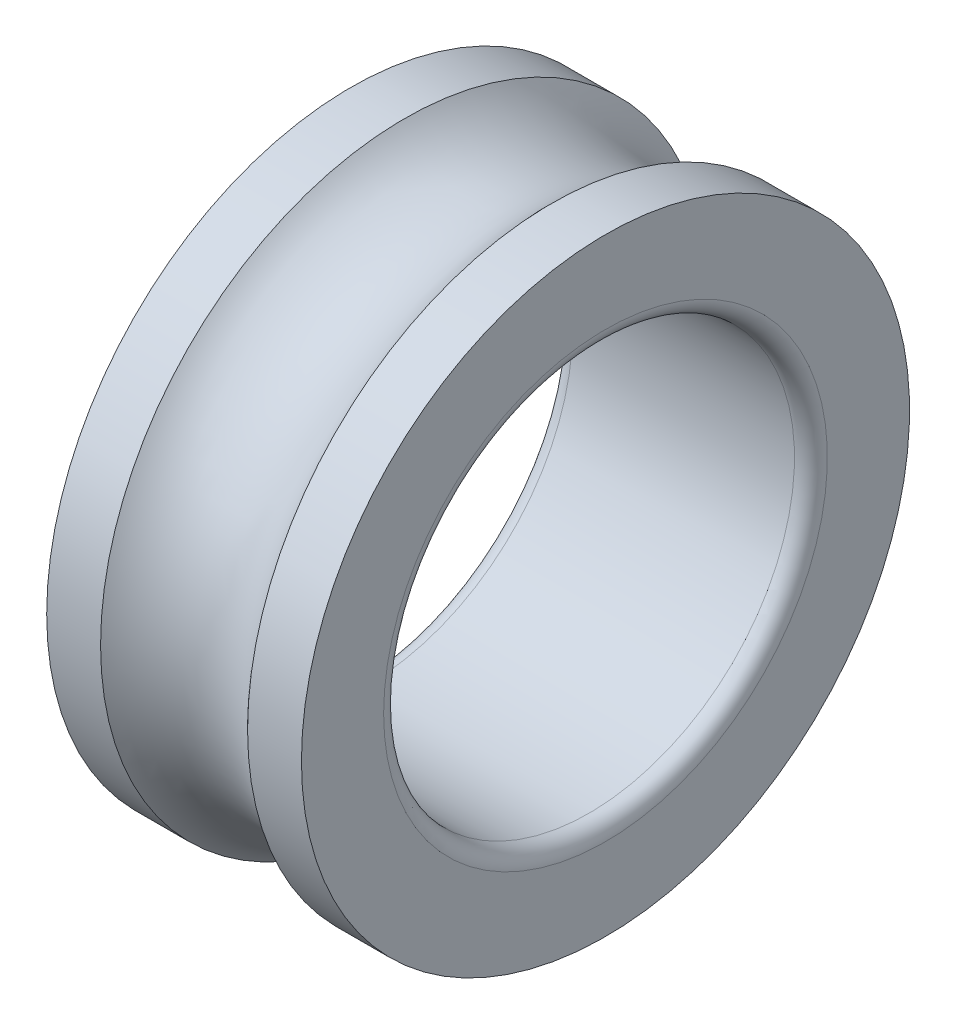
from build123d import *

# Parameters (mm, degrees)
FILLET_1_R    = 2
SCALE_1_SCALE = 0.338461538
SCALE_2_SCALE = 0.5


with BuildPart() as part:
    # 草图1 → 旋转1 (revolve)
    with BuildSketch(Plane.XY, mode=Mode.PRIVATE) as revolve_1_sk:
        with BuildLine():
            Line((-15.5, 37), (-8.94427191, 37))
            ThreePointArc((-8.94427191, 37), (0, 33), (8.94427191, 37))
            Line((8.94427191, 37), (15.5, 37))
            Line((15.5, 37), (15.5, 25))
            Line((15.5, 25), (-15.5, 25))
            Line((-15.5, 25), (-15.5, 37))
        make_face()
    revolve(revolve_1_sk.sketch.rotate(Axis((0, 0, 0), (1, 0, 0)), 90), axis=Axis((0, 0, 0), (1, 0, 0)))

    # 圆角1
    fillet_1_edges = [part.edges().sort_by_distance(p)[0] for p in [
        (15.5, 0, -25),
        (-15.5, 0, -25),
    ]]
    fillet(fillet_1_edges, radius=FILLET_1_R)


with BuildPart() as part_1:
    # 缩放比例1: scaled about (0, 0, 0)
    add(part.part.scale(SCALE_1_SCALE))


with BuildPart() as part_2:
    # 缩放比例2: scaled about (0, 0, 0)
    add(part_1.part.scale(SCALE_2_SCALE))


solid = part_2.part
